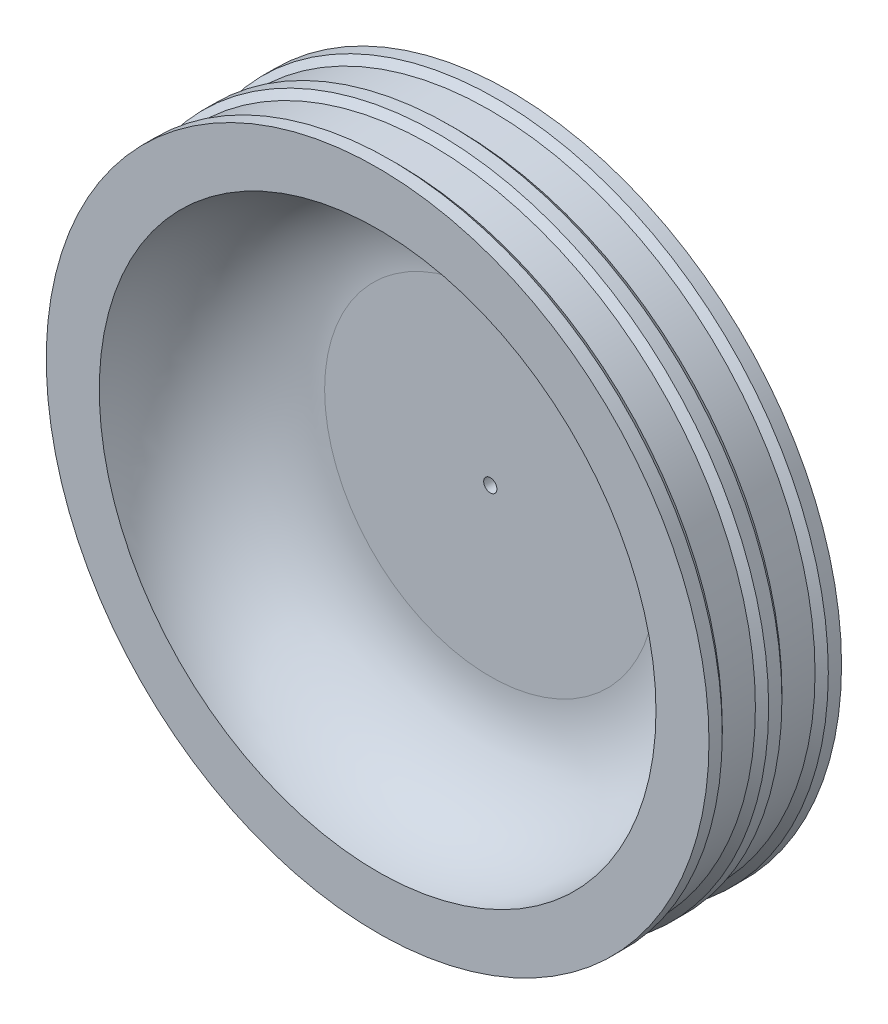
from build123d import *

# Parameters (mm, degrees)
SKETCH1_R           = 50
SKETCH1_R_2         = 1
BOSS_EXTRUDE1_DEPTH = 20


with BuildPart() as part:
    # Sketch1 → Boss-Extrude1 (new body)
    with BuildSketch(Plane.XY):
        Circle(SKETCH1_R)
        Circle(SKETCH1_R_2, mode=Mode.SUBTRACT)
    extrude(amount=BOSS_EXTRUDE1_DEPTH)

    # Sketch2 → Cut-Revolve1 (revolve, cut)
    with BuildSketch(Plane(origin=(0, 0, 0), x_dir=(0, 0, -1), z_dir=(1, 0, 0)), mode=Mode.PRIVATE) as cut_revolve1_sk:
        Polygon((-18, 50), (-17, 49), (-12, 49), (-11, 50), align=None)
        Polygon((-9, 50), (-8, 49), (-3, 49), (-2, 50), align=None)
    revolve(cut_revolve1_sk.sketch.rotate(Axis((0, 0, 1011.858451466), (0, 0, -1)), 90), axis=Axis((0, 0, 1011.858451466), (0, 0, -1)), mode=Mode.SUBTRACT)

    # Sketch4 → Cut-Revolve2 (revolve, cut)
    with BuildSketch(Plane(origin=(0, 0, 0), x_dir=(0, 0, -1), z_dir=(1, 0, 0)), mode=Mode.PRIVATE) as cut_revolve2_sk:
        with BuildLine():
            Line((-3, 0), (-3, 25))
            ThreePointArc((-3, 25), (-7.97918472, 37.02081528), (-20, 42))
            Line((-20, 42), (-20, 0))
            Line((-20, 0), (-3, 0))
        make_face()
    revolve(cut_revolve2_sk.sketch.rotate(Axis((0, 0, 1012), (0, 0, -1)), 90), axis=Axis((0, 0, 1012), (0, 0, -1)), mode=Mode.SUBTRACT)


solid = part.part
